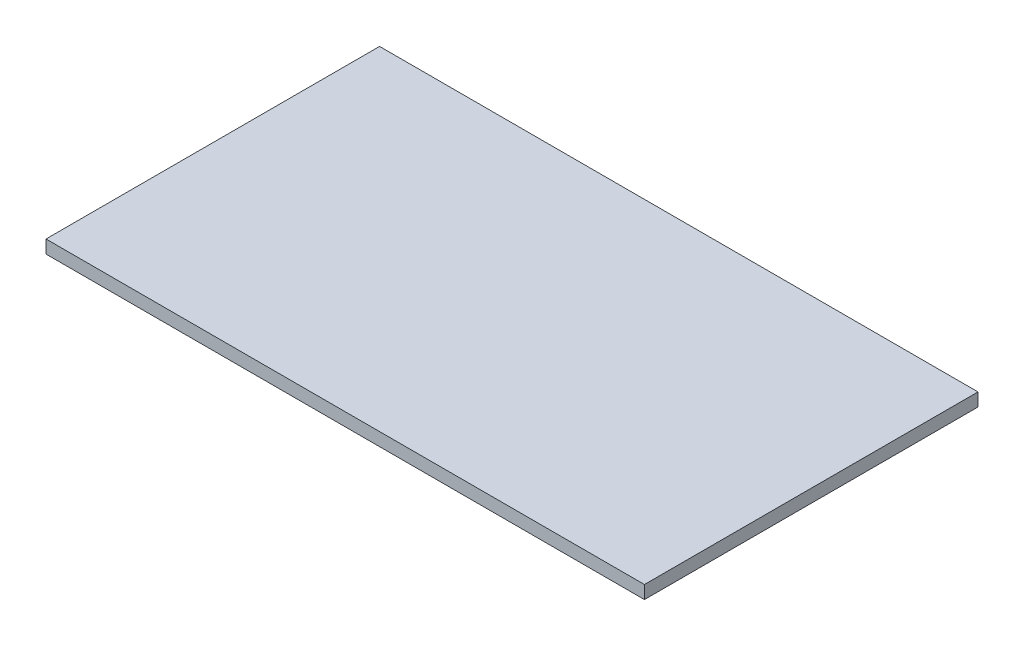
from build123d import *

# Parameters (mm, degrees)
SKETCH_1_W      = 183
SKETCH_1_H      = 102
EXTRUDE_1_DEPTH = 4


with BuildPart() as part:
    # 草图1 → 凸台-拉伸1 (new body)
    with BuildSketch(Plane(origin=(0, 0, 0), x_dir=(1, 0, 0), z_dir=(0, 1, 0))):
        with Locations((91.5, 51)):
            Rectangle(SKETCH_1_W, SKETCH_1_H)
    extrude(amount=EXTRUDE_1_DEPTH)


solid = part.part
